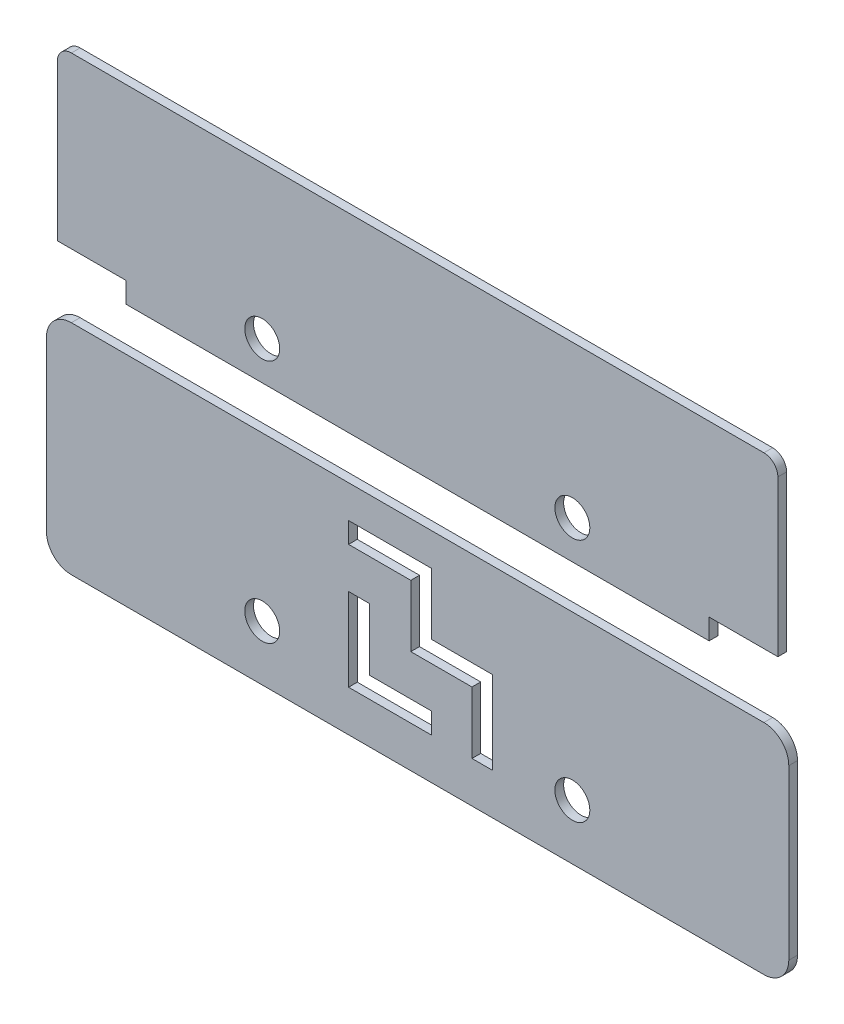
from build123d import *

# Parameters (mm, degrees)
SKETCH1_R             = 5.08
BOSS_EXTRUDE1_DEPTH   = 2.54
BOSS_EXTRUDE1_2_DEPTH = 2.54
CUT_EXTRUDE1_DEPTH    = 147.965122138


with BuildPart() as part:
    # Sketch1 → Boss-Extrude1 (new body)
    with BuildSketch(Plane.XY):
        with BuildLine():
            Line((-52.6295, -31.75), (-37.7705, -31.75))
            Line((-37.7705, -31.75), (37.5705, -31.75))
            Line((37.5705, -31.75), (52.4295, -31.75))
            Line((52.4295, -31.75), (100.711, -31.75))
            ThreePointArc((100.711, -31.75), (105.829745989, -29.629745989), (107.95, -24.511))
            Line((107.95, -24.511), (107.95, 24.511))
            ThreePointArc((107.95, 24.511), (105.829745989, 29.629745989), (100.711, 31.75))
            Line((100.711, 31.75), (-100.711, 31.75))
            ThreePointArc((-100.711, 31.75), (-105.829745989, 29.629745989), (-107.95, 24.511))
            Line((-107.95, 24.511), (-107.95, -24.511))
            ThreePointArc((-107.95, -24.511), (-105.829745989, -29.629745989), (-100.711, -31.75))
            Line((-100.711, -31.75), (-52.6295, -31.75))
        make_face()
        with Locations((-45.2, -15.6502)):
            Circle(SKETCH1_R, mode=Mode.SUBTRACT)
        with Locations((45, -15.6502)):
            Circle(SKETCH1_R, mode=Mode.SUBTRACT)
    extrude(amount=BOSS_EXTRUDE1_DEPTH)

    # Sketch2 → Cut-Extrude1 (cut, through all)
    with BuildSketch(Plane.XY.offset(2.54)):
        Polygon((-20.086392144, 22.236562491), (3.984117021, 22.236562491), (3.984117021, 4.354393448), (21.823607856, 4.354393448), (21.823607856, -19.758793925), (15.805980564, -19.758793925), (15.805980564, -1.748590259), (-1.990832063, -1.748590259), (-1.990832063, 16.218935199), (-20.086392144, 16.218935199), align=None)
        Polygon((-20.086392144, 4.354393448), (-14.026086645, 4.354393448), (-14.026086645, -13.698488426), (3.984117021, -13.698488426), (3.984117021, -19.758793925), (-20.086392144, -19.758793925), align=None)
    extrude(amount=-CUT_EXTRUDE1_DEPTH, mode=Mode.SUBTRACT)


with BuildPart() as body_2:
    # Sketch1 → Boss-Extrude1 2 (new body)
    with BuildSketch(Plane.XY):
        with BuildLine():
            Line((100.711, 99.695), (-100.711, 99.695))
            ThreePointArc((-100.711, 99.695), (-103.584681959, 98.504681959), (-104.775, 95.631))
            Line((-104.775, 95.631), (-104.775, 50.345))
            Line((-104.775, 50.345), (-84.775, 50.345))
            Line((-84.775, 50.345), (-84.775, 44.345))
            Line((-84.775, 44.345), (84.775, 44.345))
            Line((84.775, 44.345), (84.775, 50.345))
            Line((84.775, 50.345), (104.775, 50.345))
            Line((104.775, 50.345), (104.775, 95.631))
            ThreePointArc((104.775, 95.631), (103.584681959, 98.504681959), (100.711, 99.695))
        make_face()
        with Locations((-45.2, 55.4698)):
            Circle(SKETCH1_R, mode=Mode.SUBTRACT)
        with Locations((45, 55.4698)):
            Circle(SKETCH1_R, mode=Mode.SUBTRACT)
    extrude(amount=BOSS_EXTRUDE1_2_DEPTH)


solid = Compound([part.part, body_2.part])
